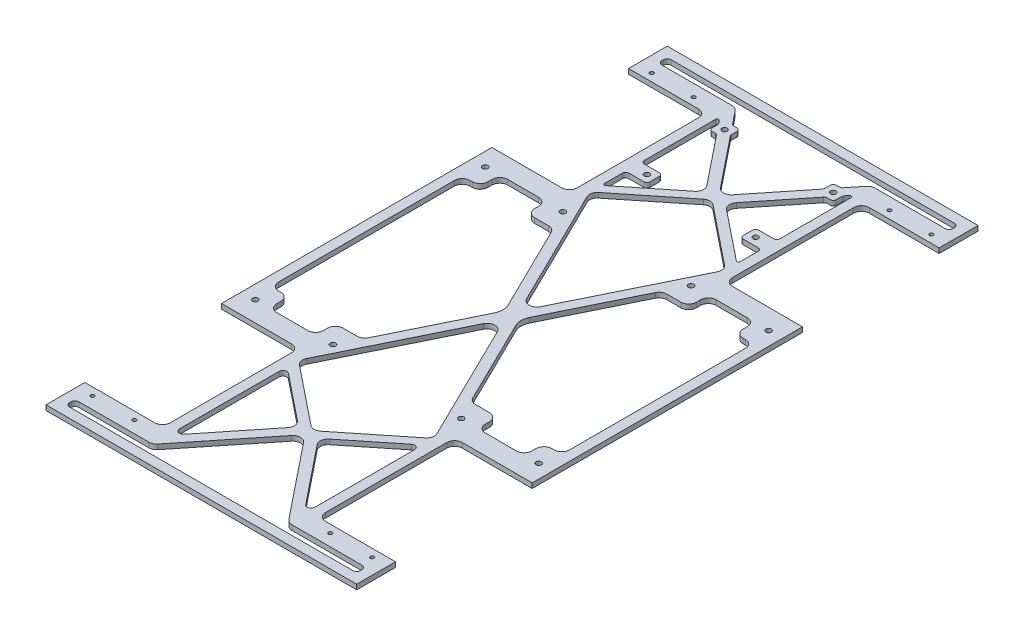
from build123d import *

# Parameters (mm, degrees)
BOSS_EXTRUDE1_DEPTH                      = 3.175
F_3_32_0_09375_DIAMETER_HOLE1_D          = 2.38125
MIRROR5_AT_THE_SECOND_PLANE_COPY_1_D     = 2.38125
CUT_EXTRUDE1_DEPTH                       = 224.629337577
MIRROR6_AT_THE_SECOND_PLANE_COPY_1_DEPTH = 224.629337577
F_3_5_3_5_DIAMETER_HOLE1_D               = 3.5
MIRROR7_AT_THE_SECOND_PLANE_COPY_1_D     = 3.5
SKETCH8_W                                = 10
SKETCH8_H                                = 10
BOSS_EXTRUDE2_DEPTH                      = 3.175
M3_CLEARANCE_HOLE1_D                     = 3.4
FILLET1_R                                = 5
FILLET2_R                                = 10
FILLET3_R                                = 2.5
FILLET5_R                                = 5
FILLET6_R                                = 5
FILLET7_R                                = 2
FILLET8_R                                = 1


with BuildPart() as part:
    # Sketch1 → Boss-Extrude1 (new body)
    with BuildSketch(Plane(origin=(0, 0, 0), x_dir=(1, 0, 0), z_dir=(0, 1, 0))):
        Polygon((-100, 87), (-100, -87), (-50, -87), (-50, -175), (-100, -175), (-100, -200), (100, -200), (100, -175), (50, -175), (50, -87), (100, -87), (100, 87), (50, 87), (50, 175), (100, 175), (100, 200), (-100, 200), (-100, 175), (-50, 175), (-50, 87), align=None)
    extrude(amount=BOSS_EXTRUDE1_DEPTH)

    # 3/32 (0.09375) Diameter Hole1 (through all)
    with Locations(Plane(origin=(0, 3.175, 0), x_dir=(1, 0, 0), z_dir=(0, 1, 0))):
        with Locations((-90, 180), (-63.06, 180)):
            f_3_32_0_09375_diameter_hole1 = Hole(F_3_32_0_09375_DIAMETER_HOLE1_D / 2)

    # Mirror5: 3/32 (0.09375) Diameter Hole1 across plane
    add(f_3_32_0_09375_diameter_hole1.mirror(Plane(origin=(0, 0, 0), x_dir=(0, 0, 1), z_dir=(1, 0, 0))), mode=Mode.SUBTRACT)

    # Mirror5 at the second plane: 3/32 (0.09375) Diameter Hole1 across plane
    add(f_3_32_0_09375_diameter_hole1.mirror(Plane.XY), mode=Mode.SUBTRACT)

    # Mirror5 at the second plane copy 1 (through all)
    with Locations(Plane(origin=(0, 3.175, 0), x_dir=(-1, 0, 0), z_dir=(0, 1, 0))):
        with Locations((-90, 180), (-63.06, 180)):
            Hole(MIRROR5_AT_THE_SECOND_PLANE_COPY_1_D / 2)

    # Sketch5 → Cut-Extrude1 (cut, symmetric)
    with BuildSketch(Plane(origin=(0, 3.175, 0), x_dir=(1, 0, 0), z_dir=(0, 1, 0))):
        Polygon((-34.942222684, 61.6), (-52.125, 61.6), (-52.125, 74.3), (-82.125, 74.3), (-82.125, 61.6), (-93.65, 61.6), (-93.65, 0), (-4.745601416, 0), align=None)
        Polygon((-43.65, 177.54559284), (-43.65, 101.109092718), (-6.35, 131), align=None)
        Polygon((-43.65, 93.79000066), (0, 128.769574463), (0, 4.745601416), align=None)
        Polygon((-93.65, 193.65), (-93.65, 187.7), (-43.65, 187.7), (0, 133.230425537), (0, 193.65), align=None)
    cut_extrude1 = extrude(amount=CUT_EXTRUDE1_DEPTH, both=True, mode=Mode.SUBTRACT)

    # Mirror6: Cut-Extrude1 across plane
    add(cut_extrude1.mirror(Plane(origin=(0, 0, 0), x_dir=(0, 0, 1), z_dir=(1, 0, 0))), mode=Mode.SUBTRACT)

    # Mirror6 at the second plane: Cut-Extrude1 across plane
    add(cut_extrude1.mirror(Plane.XY), mode=Mode.SUBTRACT)

    # Mirror6 at the second plane copy 1 sketc → Mirror6 at the second plane copy 1 (cut, symmetric)
    with BuildSketch(Plane(origin=(0, 3.175, 0), x_dir=(-1, 0, 0), z_dir=(0, 1, 0))):
        Polygon((-34.942222684, 61.6), (-52.125, 61.6), (-52.125, 74.3), (-82.125, 74.3), (-82.125, 61.6), (-93.65, 61.6), (-93.65, 0), (-4.745601416, 0), align=None)
        Polygon((-43.65, 177.54559284), (-43.65, 101.109092718), (-6.35, 131), align=None)
        Polygon((-43.65, 93.79000066), (0, 128.769574463), (0, 4.745601416), align=None)
        Polygon((-93.65, 193.65), (-93.65, 187.7), (-43.65, 187.7), (0, 133.230425537), (0, 193.65), align=None)
    extrude(amount=MIRROR6_AT_THE_SECOND_PLANE_COPY_1_DEPTH, both=True, mode=Mode.SUBTRACT)

    # Ø3.5 (3.5) Diameter Hole1 (through all)
    with Locations(Plane(origin=(0, 0, 0), x_dir=(-1, 0, 0), z_dir=(0, -1, 0))):
        with Locations((41.24, 74), (91.24, 74)):
            f_3_5_3_5_diameter_hole1 = Hole(F_3_5_3_5_DIAMETER_HOLE1_D / 2)

    # Mirror7: Ø3.5 (3.5) Diameter Hole1 across plane
    add(f_3_5_3_5_diameter_hole1.mirror(Plane(origin=(0, 0, 0), x_dir=(0, 0, 1), z_dir=(1, 0, 0))), mode=Mode.SUBTRACT)

    # Mirror7 at the second plane: Ø3.5 (3.5) Diameter Hole1 across plane
    add(f_3_5_3_5_diameter_hole1.mirror(Plane.XY), mode=Mode.SUBTRACT)

    # Mirror7 at the second plane copy 1 (through all)
    with Locations(Plane.XZ):
        with Locations((41.24, 74), (91.24, 74)):
            Hole(MIRROR7_AT_THE_SECOND_PLANE_COPY_1_D / 2)

    # Sketch8 → Boss-Extrude2 (add)
    with BuildSketch(Plane(origin=(0, 3.175, 0), x_dir=(1, 0, 0), z_dir=(0, 1, 0))):
        Polygon((-40, 116.828711217), (-30, 116.828711217), (-30, 126.828711217), (-40, 126.828711217), (-43.65, 126.828711217), (-43.65, 116.828711217), align=None)
        Polygon((30, 116.828711217), (40, 116.828711217), (43.65, 116.828711217), (43.65, 126.828711217), (40, 126.828711217), (30, 126.828711217), align=None)
        with Locations((-35, 171.828711217)):
            Rectangle(SKETCH8_W, SKETCH8_H)
        with Locations((35, 171.828711217)):
            Rectangle(SKETCH8_W, SKETCH8_H)
    extrude(amount=-BOSS_EXTRUDE2_DEPTH)

    # M3 Clearance Hole1 (through all)
    with Locations(Plane(origin=(0, 3.175, 0), x_dir=(1, 0, 0), z_dir=(0, 1, 0))):
        with Locations((-35, 171.828711217), (35, 171.828711217), (35, 121.828711217), (-35, 121.828711217)):
            Hole(M3_CLEARANCE_HOLE1_D / 2)

    # Fillet1
    fillet1_edges = [part.edges().sort_by_distance(p)[0] for p in [
        (-34.942222684, 1.5875, -61.6),
        (-93.65, 1.5875, -61.6),
        (-82.125, 1.5875, -61.6),
        (-82.125, 1.5875, -74.3),
        (-52.125, 1.5875, -74.3),
        (-52.125, 1.5875, -61.6),
        (0, 1.5875, -4.745601416),
        (-34.942222684, 1.5875, 61.6),
        (-52.125, 1.5875, 61.6),
        (-52.125, 1.5875, 74.3),
        (-82.125, 1.5875, 74.3),
        (-82.125, 1.5875, 61.6),
        (-93.65, 1.5875, 61.6),
        (-6.35, 1.5875, 131),
        (-43.65, 1.5875, 93.79000066),
        (0, 1.5875, 4.745601416),
        (0, 1.5875, 128.769574463),
        (-43.65, 1.5875, 187.7),
        (0, 1.5875, 133.230425537),
        (34.942222684, 1.5875, -61.6),
        (52.125, 1.5875, -61.6),
        (52.125, 1.5875, -74.3),
        (82.125, 1.5875, -74.3),
        (82.125, 1.5875, -61.6),
        (93.65, 1.5875, -61.6),
        (93.65, 1.5875, 61.6),
        (82.125, 1.5875, 61.6),
        (82.125, 1.5875, 74.3),
        (52.125, 1.5875, 74.3),
        (52.125, 1.5875, 61.6),
        (34.942222684, 1.5875, 61.6),
        (6.35, 1.5875, 131),
        (43.65, 1.5875, 93.79000066),
        (43.65, 1.5875, 187.7),
    ]]
    fillet(fillet1_edges, radius=FILLET1_R)

    # Fillet2
    fillet2_edges = [part.edges().sort_by_distance(p)[0] for p in [
        (-4.745601416, 1.5875, 0),
        (4.745601416, 1.5875, 0),
    ]]
    fillet(fillet2_edges, radius=FILLET2_R)

    # Fillet3
    fillet3_edges = [part.edges().sort_by_distance(p)[0] for p in [
        (-93.65, 1.5875, -193.65),
        (-93.65, 1.5875, -187.7),
        (-43.65, 1.5875, 177.54559284),
        (-43.65, 1.5875, 101.109092718),
        (-93.65, 1.5875, 193.65),
        (-93.65, 1.5875, 187.7),
        (93.65, 1.5875, -193.65),
        (93.65, 1.5875, -187.7),
        (43.65, 1.5875, 177.54559284),
        (43.65, 1.5875, 101.109092718),
        (93.65, 1.5875, 187.7),
        (93.65, 1.5875, 193.65),
    ]]
    fillet(fillet3_edges, radius=FILLET3_R)

    # Fillet5
    fillet5_edges = [part.edges().sort_by_distance(p)[0] for p in [
        (-43.65, 1.5875, -93.79000066),
        (-43.65, 1.5875, -187.7),
        (50, 1.5875, -175),
        (50, 1.5875, -87),
        (50, 1.5875, 87),
        (50, 1.5875, 175),
        (-50, 1.5875, 175),
        (-50, 1.5875, 87),
        (43.65, 1.5875, -93.79000066),
        (-50, 1.5875, -87),
        (-50, 1.5875, -175),
        (43.65, 1.5875, -187.7),
    ]]
    fillet(fillet5_edges, radius=FILLET5_R)

    # Fillet6
    fillet6_edges = [part.edges().sort_by_distance(p)[0] for p in [
        (-6.35, 1.5875, -131),
        (0, 1.5875, -128.769574463),
        (0, 1.5875, -133.230425537),
        (6.35, 1.5875, -131),
    ]]
    fillet(fillet6_edges, radius=FILLET6_R)

    # Fillet7
    fillet7_edges = [part.edges().sort_by_distance(p)[0] for p in [
        (-43.65, 1.5875, -116.828711217),
        (-43.65, 1.5875, -126.828711217),
        (-30, 1.5875, -126.828711217),
        (-30, 1.5875, -116.828711217),
        (-40, 1.5875, -172.990863246),
        (-35.061868232, 1.5875, -166.828711217),
        (-34.938131768, 1.5875, -176.828711217),
        (-30, 1.5875, -170.666559188),
        (-30, 1.5875, -176.828711217),
        (-40, 1.5875, -166.828711217),
        (35.061868232, 1.5875, -166.828711217),
        (40, 1.5875, -172.990863246),
        (30, 1.5875, -170.666559188),
        (34.938131768, 1.5875, -176.828711217),
        (30, 1.5875, -176.828711217),
        (40, 1.5875, -166.828711217),
        (30, 1.5875, -116.828711217),
        (30, 1.5875, -126.828711217),
        (43.65, 1.5875, -126.828711217),
        (43.65, 1.5875, -116.828711217),
    ]]
    fillet(fillet7_edges, radius=FILLET7_R)

    # Fillet8
    fillet8_edges = [part.edges().sort_by_distance(p)[0] for p in [
        (-43.65, 1.5875, -177.54559284),
        (-43.65, 1.5875, -101.109092718),
        (43.65, 1.5875, -177.54559284),
        (43.65, 1.5875, -101.109092718),
    ]]
    fillet(fillet8_edges, radius=FILLET8_R)


solid = part.part
